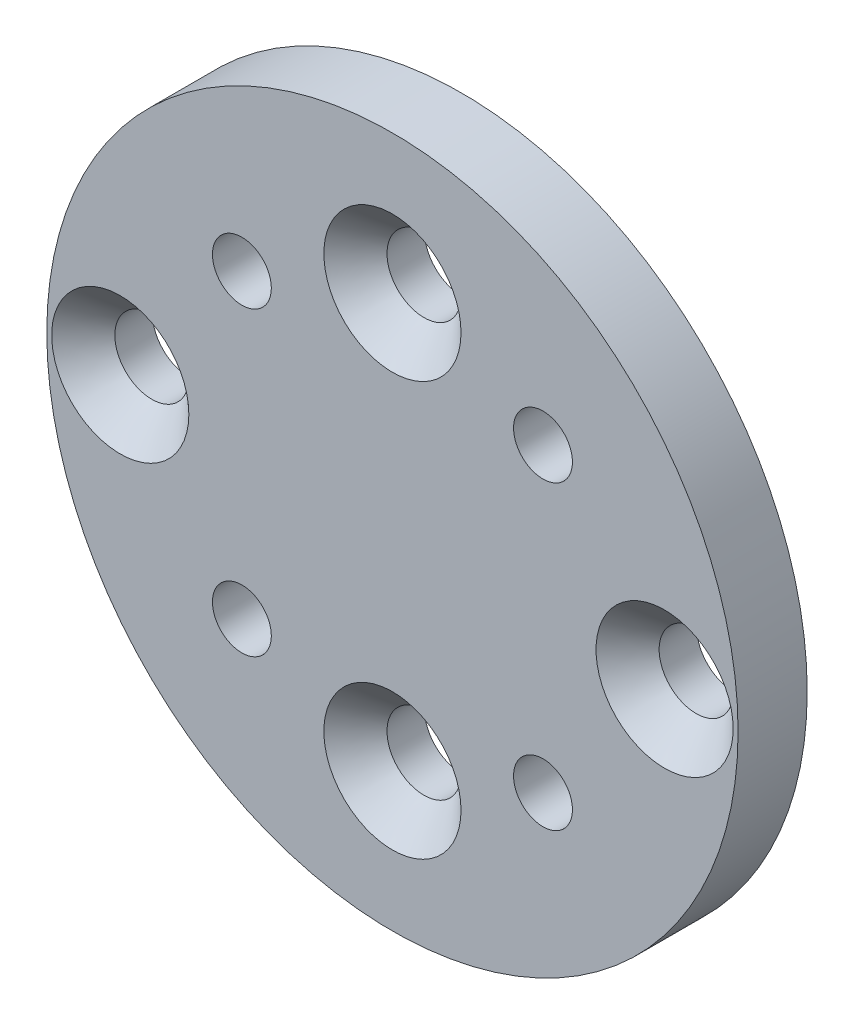
from build123d import *

# Parameters (mm, degrees)
SKETCH1_R                                       = 15.875
BOSS_EXTRUDE1_DEPTH                             = 3.175
CSK_FOR_M3_FLAT_HEAD_MACHINE_SCREW1_D           = 3.4
CSK_FOR_M3_FLAT_HEAD_MACHINE_SCREW1_CSINK_D     = 6.3
CSK_FOR_M3_FLAT_HEAD_MACHINE_SCREW1_CSINK_ANGLE = 90
F_6_32_TAPPED_HOLE1_D                           = 2.7051


with BuildPart() as part:
    # Sketch1 → Boss-Extrude1 (new body)
    with BuildSketch(Plane.XY):
        Circle(SKETCH1_R)
    extrude(amount=BOSS_EXTRUDE1_DEPTH)

    # CSK for M3 Flat Head Machine Screw1 (through all)
    with Locations(Plane.XY.offset(3.175)):
        with Locations((0, 9.5), (0, -9.5), (12.5, 0), (-12.5, 0)):
            CounterSinkHole(CSK_FOR_M3_FLAT_HEAD_MACHINE_SCREW1_D / 2, CSK_FOR_M3_FLAT_HEAD_MACHINE_SCREW1_CSINK_D / 2, counter_sink_angle=CSK_FOR_M3_FLAT_HEAD_MACHINE_SCREW1_CSINK_ANGLE)

    # #6-32 Tapped Hole1 (through all)
    with Locations(Plane.XY.offset(3.175)):
        with Locations((-6.914797213, 6.914797213), (6.914797213, 6.914797213), (6.914797213, -6.914797213), (-6.914797213, -6.914797213)):
            Hole(F_6_32_TAPPED_HOLE1_D / 2)


solid = part.part
